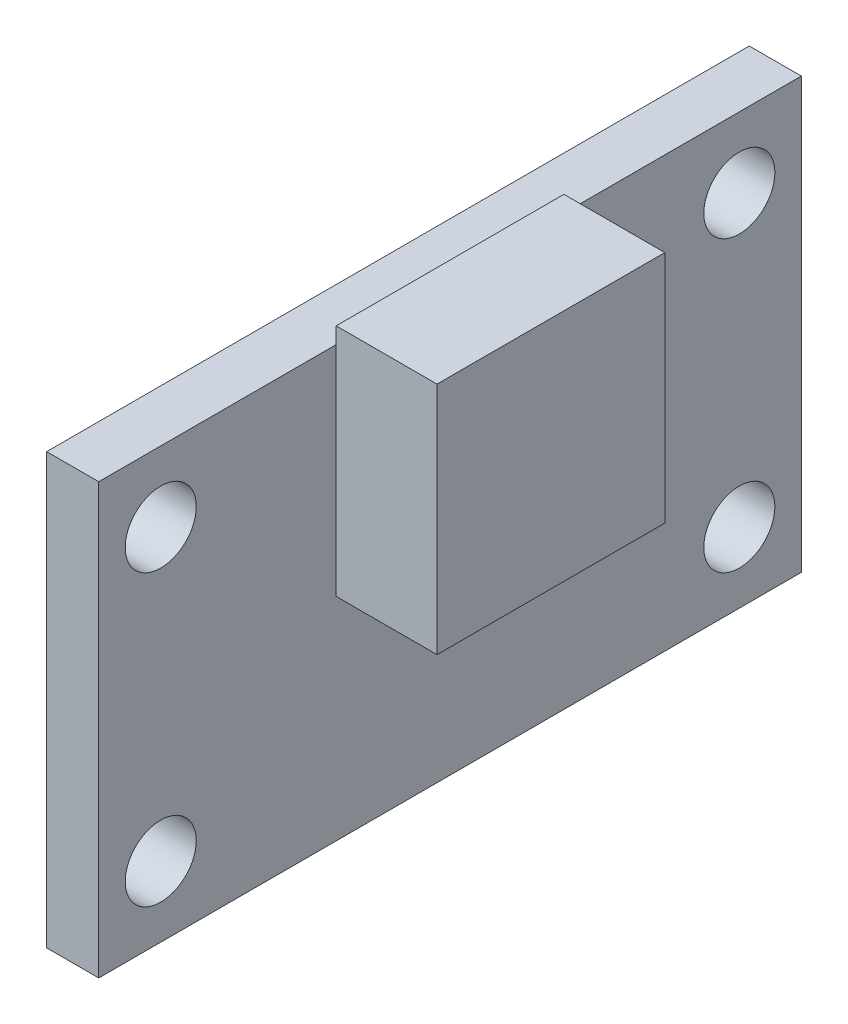
from build123d import *

# Parameters (mm, degrees)
SKETCH1_W                   = 21.59
SKETCH1_H                   = 13.208
BOSS_EXTRUDE1_DEPTH         = 1.6
F_44_0_086_DIAMETER_HOLE1_D = 2.1844
SKETCH4_W                   = 7
SKETCH4_H                   = 7.2
BOSS_EXTRUDE2_DEPTH         = 3.1


with BuildPart() as part:
    # Sketch1 → Boss-Extrude1 (new body)
    with BuildSketch(Plane(origin=(0, 0, 0), x_dir=(0, 0, -1), z_dir=(1, 0, 0))):
        with Locations((10.795, 6.604)):
            Rectangle(SKETCH1_W, SKETCH1_H)
    extrude(amount=BOSS_EXTRUDE1_DEPTH)

    # #44 (0.086) Diameter Hole1 (through all)
    with Locations(Plane(origin=(1.6, 0, 0), x_dir=(0, 0, -1), z_dir=(1, 0, 0))):
        with Locations((1.905, 11.049), (19.685, 11.049), (19.685, 2.159), (1.905, 2.159)):
            Hole(F_44_0_086_DIAMETER_HOLE1_D / 2)

    # Sketch4 → Boss-Extrude2 (add)
    with BuildSketch(Plane(origin=(1.6, 0, 0), x_dir=(0, 0, -1), z_dir=(1, 0, 0))):
        with Locations((10.795, 10.108)):
            Rectangle(SKETCH4_W, SKETCH4_H)
    extrude(amount=BOSS_EXTRUDE2_DEPTH)


solid = part.part
